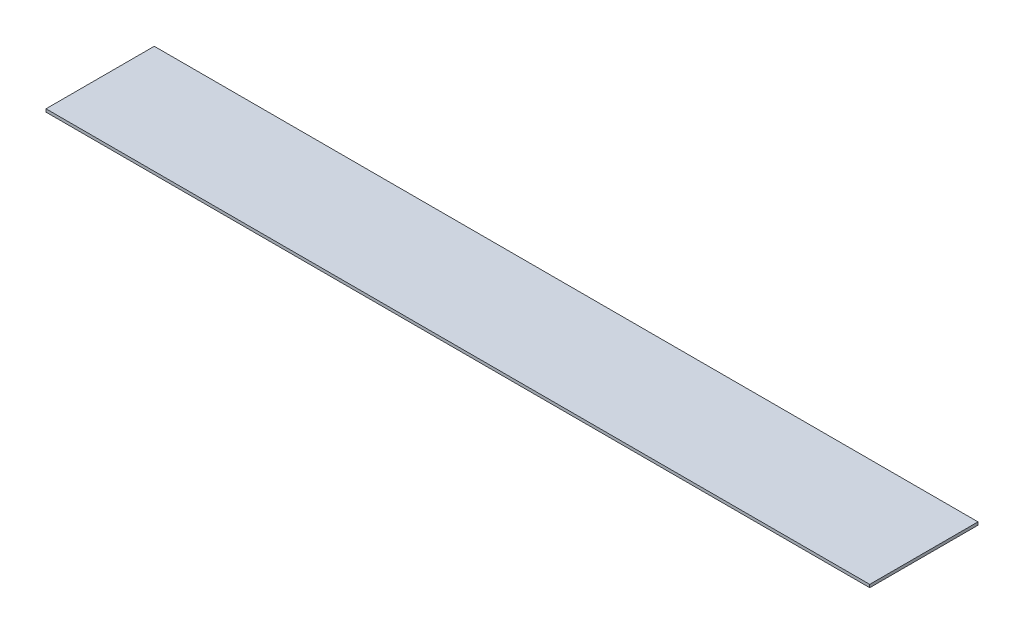
from build123d import *

# Parameters (mm, degrees)
SKETCH1_W           = 1787.525
SKETCH1_H           = 234.95
BOSS_EXTRUDE1_DEPTH = 6.35


with BuildPart() as part:
    # Sketch1 → Boss-Extrude1 (new body)
    with BuildSketch(Plane(origin=(0, 0, 0), x_dir=(1, 0, 0), z_dir=(0, 1, 0))):
        Rectangle(SKETCH1_W, SKETCH1_H)
    extrude(amount=BOSS_EXTRUDE1_DEPTH)


solid = part.part
